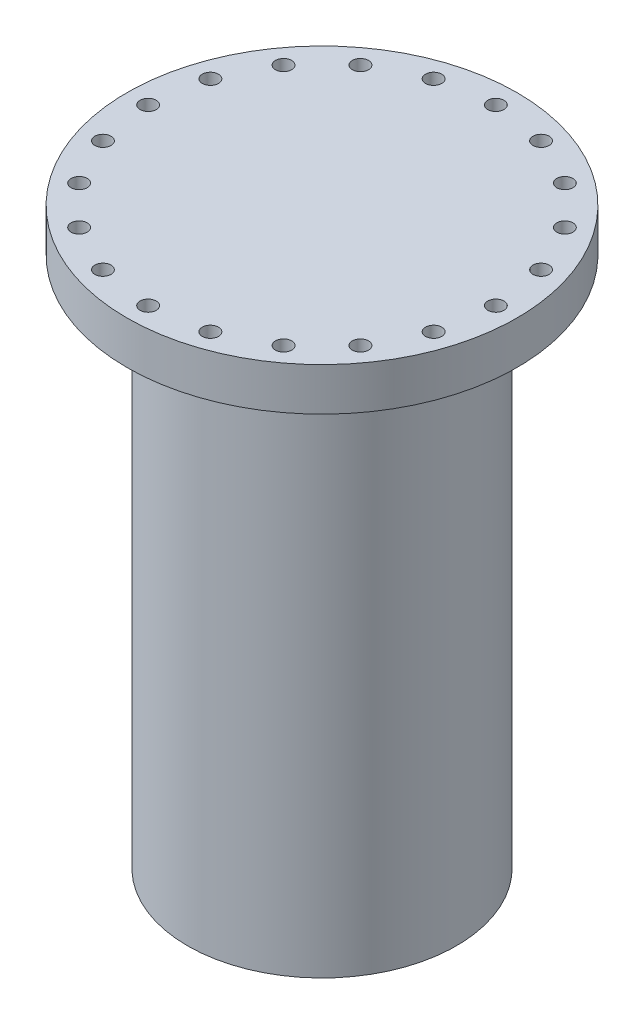
from build123d import *

# Parameters (mm, degrees)
SKETCH1_R         = 101.6
EXTRUDE1_DEPTH    = 22.352
SKETCH5_R         = 70
SKETCH5_R_2       = 67.46
EXTRUDE2_DEPTH    = 276.606
SKETCH6_R         = 4.2164
EXTRUDE3_DEPTH    = 332.694144905
CIRPATTERN1_COUNT = 20


with BuildPart() as part:
    # Sketch1 → Extrude1 (new body)
    with BuildSketch(Plane(origin=(0, 0, 0), x_dir=(1, 0, 0), z_dir=(0, 1, 0))):
        with Locations(Location((0, 0, 0), (0, 0, 270))):
            Circle(SKETCH1_R)
    extrude(amount=EXTRUDE1_DEPTH)

    # Sketch5 → Extrude2 (add)
    with BuildSketch(Plane.XZ):
        with Locations(Location((0, 0, 0), (0, 0, 90))):
            Circle(SKETCH5_R)
        with Locations(Location((0, 0, 0), (0, 0, 270))):
            Circle(SKETCH5_R_2, mode=Mode.SUBTRACT)
    extrude(amount=EXTRUDE2_DEPTH)

    # Sketch6 → Extrude3 (cut, through all)
    with BuildSketch(Plane(origin=(0, 22.352, 0), x_dir=(1, 0, 0), z_dir=(0, 1, 0))):
        with Locations(Location((0, 90.5256, 0), (0, 0, 270))):
            Circle(SKETCH6_R)
    extrude3 = extrude(amount=-EXTRUDE3_DEPTH, mode=Mode.SUBTRACT)

    # CirPattern1: Extrude3 ×20 about axis
    cirpattern1_axis = Axis((0, 0, 0), (0, 1, 0))
    for i in range(1, CIRPATTERN1_COUNT):
        add(extrude3.rotate(cirpattern1_axis, i * 360 / CIRPATTERN1_COUNT), mode=Mode.SUBTRACT)


solid = part.part
